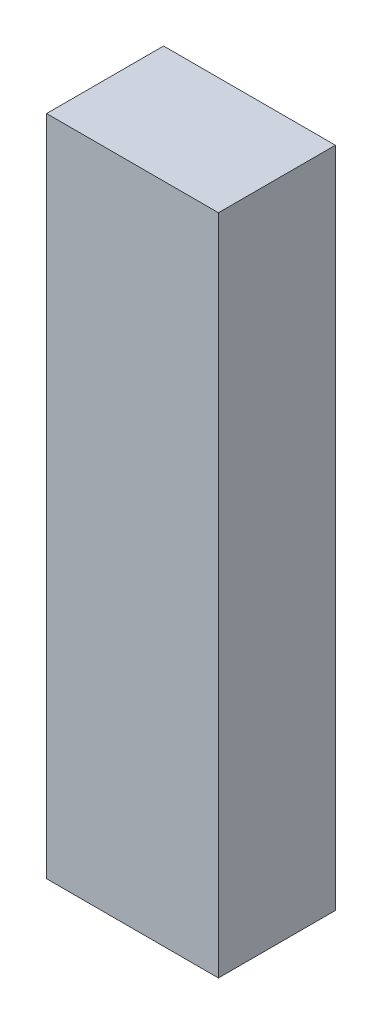
from build123d import *

# Parameters (mm, degrees)
SKETCH1_W           = 14
SKETCH1_H           = 54
BOSS_EXTRUDE1_DEPTH = 9.53


with BuildPart() as part:
    # Sketch1 → Boss-Extrude1 (new body)
    with BuildSketch(Plane.XY):
        with Locations((7, -27)):
            Rectangle(SKETCH1_W, SKETCH1_H)
    extrude(amount=-BOSS_EXTRUDE1_DEPTH)


solid = part.part
